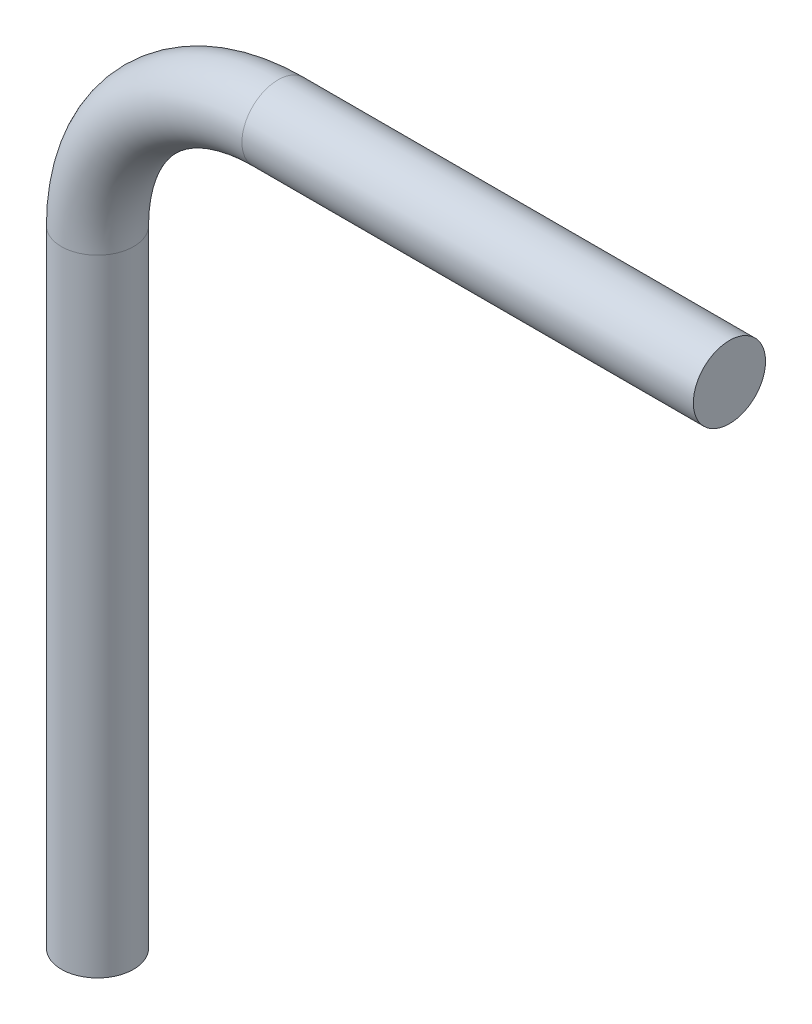
from build123d import *

# Parameters (mm, degrees)
SKETCH1_R           = 0.4
BOSS_EXTRUDE1_DEPTH = 2.5
SWEEP1_PROFILE_R    = 0.4


with BuildPart() as part:
    # Sketch1 → Boss-Extrude1 (new, symmetric)
    with BuildSketch(Plane(origin=(0, 0, 0), x_dir=(0, 0, -1), z_dir=(1, 0, 0))):
        Circle(SKETCH1_R)
    extrude(amount=BOSS_EXTRUDE1_DEPTH, both=True)

    # Sweep1: sweep along a path in Sketch2
    with BuildLine(Plane.XY) as sweep1_path:
        Line((-4.5, -8.933430799), (-4.5, -2.000020719))
        ThreePointArc((-4.5, -2.000020719), (-3.914220888, -0.585793763), (-2.5, 0))
    # Sweep1 profile (on start of the path) → Sweep1 (sweep)
    with BuildSketch(Plane(origin=(-4.5, -8.933430799, 0), x_dir=(1, 0, 0), z_dir=(0, 1, 0))):
        Circle(SWEEP1_PROFILE_R)
    sweep(path=sweep1_path.line)


solid = part.part
